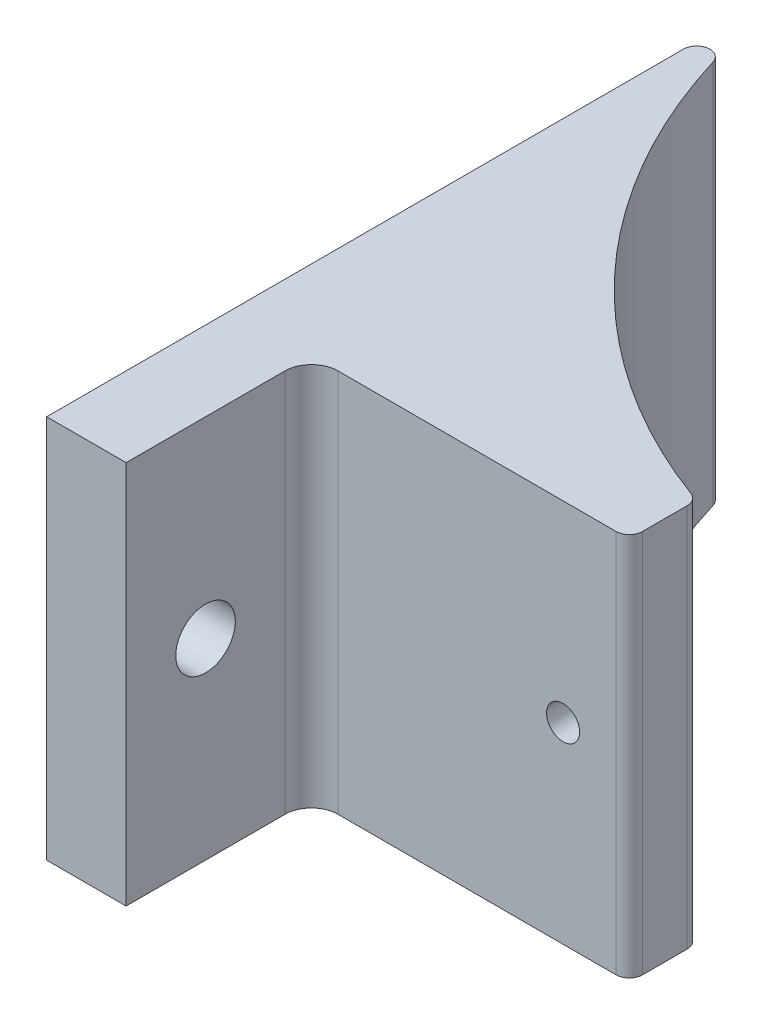
from build123d import *

# Parameters (mm, degrees)
BOSS_EXTRUDE1_DEPTH     = 14.5
SKETCH2_R               = 2.25
CUT_EXTRUDE1_DEPTH      = 68.590679831
CUT_EXTRUDE2_DEPTH      = 59.873665056
CUT_EXTRUDE2_DEPTH_BACK = 59.873665056
SKETCH3_R               = 1.25


with BuildPart() as part:
    # Sketch1 → Boss-Extrude1 (new, symmetric)
    with BuildSketch(Plane(origin=(0, 0, 0), x_dir=(1, 0, 0), z_dir=(0, 1, 0))):
        with BuildLine():
            Line((-45, -13.416407865), (-45, -61.5))
            Line((-45, -61.5), (-39, -61.5))
            Line((-39, -61.5), (-39, -49.5))
            ThreePointArc((-39, -49.5), (-38.414213562, -48.085786438), (-37, -47.5))
            Line((-37, -47.5), (-16, -47.5))
            ThreePointArc((-16, -47.5), (-15.292893219, -47.207106781), (-15, -46.5))
            Line((-15, -46.5), (-15, -43.127717306))
            ThreePointArc((-15, -43.127717306), (-15.179077931, -42.556677065), (-15.652173913, -42.190158234))
            ThreePointArc((-15.652173913, -42.190158234), (-32.748960764, -30.862688944), (-43.043478261, -13.124746824))
            ThreePointArc((-43.043478261, -13.124746824), (-44.147441956, -12.427337155), (-45, -13.416407865))
        make_face()
    extrude(amount=BOSS_EXTRUDE1_DEPTH, both=True)

    # Sketch2 → Cut-Extrude1 (cut, through all)
    with BuildSketch(Plane(origin=(-39, 0, 0), x_dir=(0, 0, -1), z_dir=(1, 0, 0))):
        with Locations((-55.5, 0)):
            Circle(SKETCH2_R)
    extrude(amount=-CUT_EXTRUDE1_DEPTH, mode=Mode.SUBTRACT)

    # Sketch3 → Cut-Extrude2 (cut, two sides: drawn at the far end of the back side and taken through both)
    with BuildSketch(Plane.XY.offset(47.5).offset(-CUT_EXTRUDE2_DEPTH_BACK)):
        with Locations((-20, 0)):
            Circle(SKETCH3_R)
    extrude(amount=CUT_EXTRUDE2_DEPTH + CUT_EXTRUDE2_DEPTH_BACK, mode=Mode.SUBTRACT)


solid = part.part
